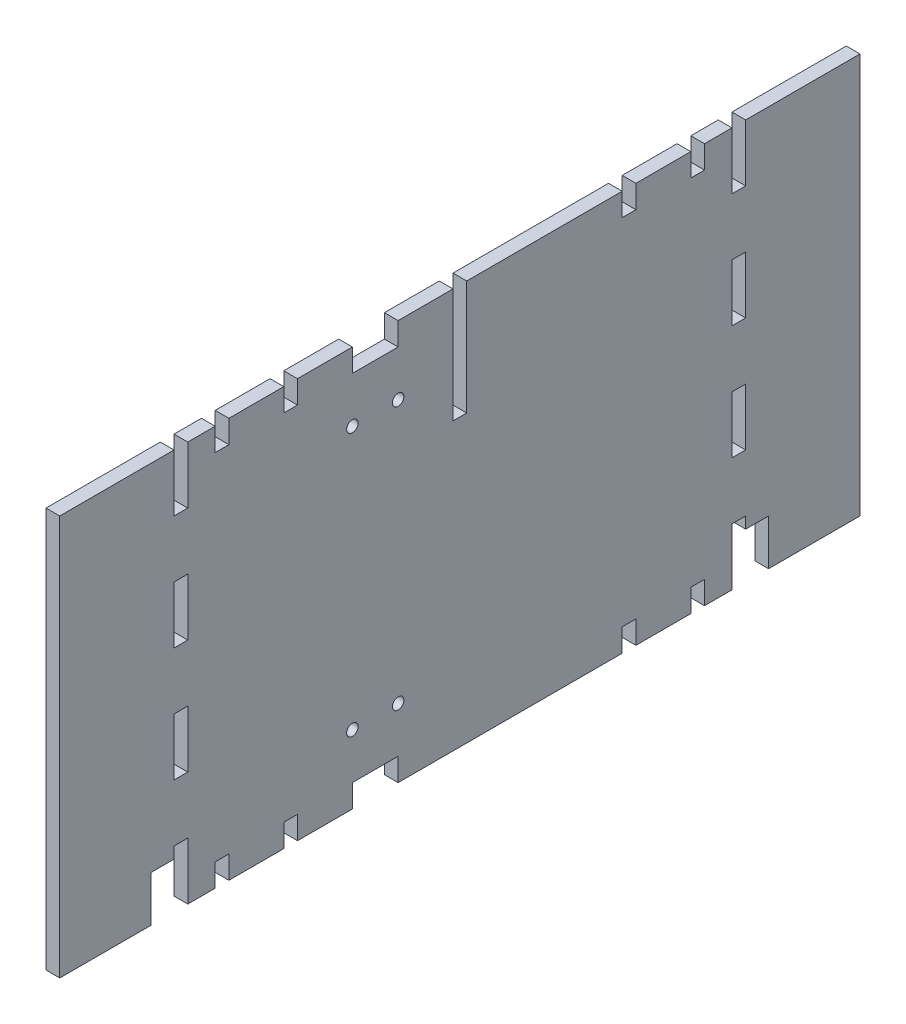
from build123d import *

# Parameters (mm, degrees)
SKETCH1_W               = 350
SKETCH1_H               = 175
BOSS_EXTRUDE1_DEPTH     = 6
SKETCH3_W               = 6
SKETCH3_H               = 25
CUT_EXTRUDE1_DEPTH      = 392.357892472
LPATTERN1_COUNT         = 4
LPATTERN1_PITCH         = 50
SKETCH4_W               = 6
SKETCH4_H               = 10
CUT_EXTRUDE2_DEPTH      = 392.357892472
LPATTERN2_COUNT         = 2
LPATTERN2_PITCH         = 165
SKETCH5_W               = 6
SKETCH5_H               = 10
CUT_EXTRUDE3_DEPTH      = 392.357892472
LPATTERN3_COUNT         = 2
LPATTERN3_PITCH         = 165
SKETCH6_W               = 6
SKETCH6_H               = 50
CUT_EXTRUDE4_DEPTH      = 10
SKETCH7_W               = 20
SKETCH7_H               = 10
CUT_EXTRUDE5_DEPTH      = 10
LPATTERN4_COUNT         = 2
LPATTERN4_PITCH         = 165
SKETCH8_R               = 2.5
CUT_EXTRUDE6_DEPTH      = 10
SKETCH9_W               = 10
SKETCH9_H               = 20
CUT_EXTRUDE7_DEPTH      = 10
MIRROR1_COPY_1_SKETCH_W = 6
MIRROR1_COPY_1_SKETCH_H = 25
MIRROR1_COPY_1_DEPTH    = 392.357892472
MIRROR1_COPY_2_SKETCH_W = 6
MIRROR1_COPY_2_SKETCH_H = 25
MIRROR1_COPY_2_DEPTH    = 392.357892472
MIRROR1_COPY_3_SKETCH_W = 6
MIRROR1_COPY_3_SKETCH_H = 25
MIRROR1_COPY_3_DEPTH    = 392.357892472
MIRROR1_COPY_4_SKETCH_W = 6
MIRROR1_COPY_4_SKETCH_H = 10
MIRROR1_COPY_4_DEPTH    = 392.357892472
MIRROR1_COPY_5_SKETCH_W = 6
MIRROR1_COPY_5_SKETCH_H = 10
MIRROR1_COPY_5_DEPTH    = 392.357892472


with BuildPart() as part:
    # Sketch1 → Boss-Extrude1 (new body)
    with BuildSketch(Plane(origin=(0, 0, 0), x_dir=(0, 0, -1), z_dir=(1, 0, 0))):
        with Locations((-175, 87.5)):
            Rectangle(SKETCH1_W, SKETCH1_H)
    extrude(amount=BOSS_EXTRUDE1_DEPTH)

    # Sketch3 → Cut-Extrude1 (cut, through all)
    with BuildSketch(Plane(origin=(6, 0, 0), x_dir=(0, 0, -1), z_dir=(1, 0, 0))):
        with Locations((-297, 162.5)):
            Rectangle(SKETCH3_W, SKETCH3_H)
    cut_extrude1 = extrude(amount=-CUT_EXTRUDE1_DEPTH, mode=Mode.SUBTRACT)

    # LPattern1: Cut-Extrude1 ×4
    with Locations(*[(0, -i * LPATTERN1_PITCH, 0) for i in range(1, LPATTERN1_COUNT)]):
        add(cut_extrude1, mode=Mode.SUBTRACT)

    # Sketch4 → Cut-Extrude2 (cut, through all)
    with BuildSketch(Plane(origin=(6, 0, 0), x_dir=(0, 0, -1), z_dir=(1, 0, 0))):
        with Locations((-279, 170)):
            Rectangle(SKETCH4_W, SKETCH4_H)
    cut_extrude2 = extrude(amount=-CUT_EXTRUDE2_DEPTH, mode=Mode.SUBTRACT)

    # LPattern2: Cut-Extrude2 ×2
    with Locations(*[(0, -i * LPATTERN2_PITCH, 0) for i in range(1, LPATTERN2_COUNT)]):
        add(cut_extrude2, mode=Mode.SUBTRACT)

    # Sketch5 → Cut-Extrude3 (cut, through all)
    with BuildSketch(Plane(origin=(6, 0, 0), x_dir=(0, 0, -1), z_dir=(1, 0, 0))):
        with Locations((-249, 170)):
            Rectangle(SKETCH5_W, SKETCH5_H)
    cut_extrude3 = extrude(amount=-CUT_EXTRUDE3_DEPTH, mode=Mode.SUBTRACT)

    # LPattern3: Cut-Extrude3 ×2
    with Locations(*[(0, -i * LPATTERN3_PITCH, 0) for i in range(1, LPATTERN3_COUNT)]):
        add(cut_extrude3, mode=Mode.SUBTRACT)

    # Sketch6 → Cut-Extrude4 (cut)
    with BuildSketch(Plane(origin=(6, 0, 0), x_dir=(0, 0, -1), z_dir=(1, 0, 0))):
        with Locations((-175, 150)):
            Rectangle(SKETCH6_W, SKETCH6_H)
    extrude(amount=-CUT_EXTRUDE4_DEPTH, mode=Mode.SUBTRACT)

    # Sketch7 → Cut-Extrude5 (cut)
    with BuildSketch(Plane(origin=(6, 0, 0), x_dir=(0, 0, -1), z_dir=(1, 0, 0))):
        with Locations((-212, 170)):
            Rectangle(SKETCH7_W, SKETCH7_H)
    cut_extrude5 = extrude(amount=-CUT_EXTRUDE5_DEPTH, mode=Mode.SUBTRACT)

    # LPattern4: Cut-Extrude5 ×2
    with Locations(*[(0, -i * LPATTERN4_PITCH, 0) for i in range(1, LPATTERN4_COUNT)]):
        add(cut_extrude5, mode=Mode.SUBTRACT)

    # Sketch8 → Cut-Extrude6 (cut)
    with BuildSketch(Plane(origin=(6, 0, 0), x_dir=(0, 0, -1), z_dir=(1, 0, 0))):
        with Locations((-222, 145)):
            Circle(SKETCH8_R)
        with Locations((-202, 145)):
            Circle(SKETCH8_R)
        with Locations((-222, 30)):
            Circle(SKETCH8_R)
        with Locations((-202, 30)):
            Circle(SKETCH8_R)
    extrude(amount=-CUT_EXTRUDE6_DEPTH, mode=Mode.SUBTRACT)

    # Sketch9 → Cut-Extrude7 (cut)
    with BuildSketch(Plane(origin=(6, 0, 0), x_dir=(0, 0, -1), z_dir=(1, 0, 0))):
        with Locations((-305, 10)):
            Rectangle(SKETCH9_W, SKETCH9_H)
    cut_extrude7 = extrude(amount=-CUT_EXTRUDE7_DEPTH, mode=Mode.SUBTRACT)

    # Mirror1: Cut-Extrude1, Cut-Extrude2, Cut-Extrude3, Cut-Extrude7 across plane
    add(cut_extrude1.mirror(Plane.XY.offset(175)), mode=Mode.SUBTRACT)
    add(cut_extrude2.mirror(Plane.XY.offset(175)), mode=Mode.SUBTRACT)
    add(cut_extrude3.mirror(Plane.XY.offset(175)), mode=Mode.SUBTRACT)
    add(cut_extrude7.mirror(Plane.XY.offset(175)), mode=Mode.SUBTRACT)

    # Mirror1 copy 1 sketch → Mirror1 copy 1 (cut, through all)
    with BuildSketch(Plane(origin=(6, -50, 350), x_dir=(0, 0, 1), z_dir=(1, 0, 0))):
        with Locations((-297, -162.5)):
            Rectangle(MIRROR1_COPY_1_SKETCH_W, MIRROR1_COPY_1_SKETCH_H)
    extrude(amount=-MIRROR1_COPY_1_DEPTH, mode=Mode.SUBTRACT)

    # Mirror1 copy 2 sketch → Mirror1 copy 2 (cut, through all)
    with BuildSketch(Plane(origin=(6, -100, 350), x_dir=(0, 0, 1), z_dir=(1, 0, 0))):
        with Locations((-297, -162.5)):
            Rectangle(MIRROR1_COPY_2_SKETCH_W, MIRROR1_COPY_2_SKETCH_H)
    extrude(amount=-MIRROR1_COPY_2_DEPTH, mode=Mode.SUBTRACT)

    # Mirror1 copy 3 sketch → Mirror1 copy 3 (cut, through all)
    with BuildSketch(Plane(origin=(6, -150, 350), x_dir=(0, 0, 1), z_dir=(1, 0, 0))):
        with Locations((-297, -162.5)):
            Rectangle(MIRROR1_COPY_3_SKETCH_W, MIRROR1_COPY_3_SKETCH_H)
    extrude(amount=-MIRROR1_COPY_3_DEPTH, mode=Mode.SUBTRACT)

    # Mirror1 copy 4 sketch → Mirror1 copy 4 (cut, through all)
    with BuildSketch(Plane(origin=(6, -165, 350), x_dir=(0, 0, 1), z_dir=(1, 0, 0))):
        with Locations((-279, -170)):
            Rectangle(MIRROR1_COPY_4_SKETCH_W, MIRROR1_COPY_4_SKETCH_H)
    extrude(amount=-MIRROR1_COPY_4_DEPTH, mode=Mode.SUBTRACT)

    # Mirror1 copy 5 sketch → Mirror1 copy 5 (cut, through all)
    with BuildSketch(Plane(origin=(6, -165, 350), x_dir=(0, 0, 1), z_dir=(1, 0, 0))):
        with Locations((-249, -170)):
            Rectangle(MIRROR1_COPY_5_SKETCH_W, MIRROR1_COPY_5_SKETCH_H)
    extrude(amount=-MIRROR1_COPY_5_DEPTH, mode=Mode.SUBTRACT)


solid = part.part
